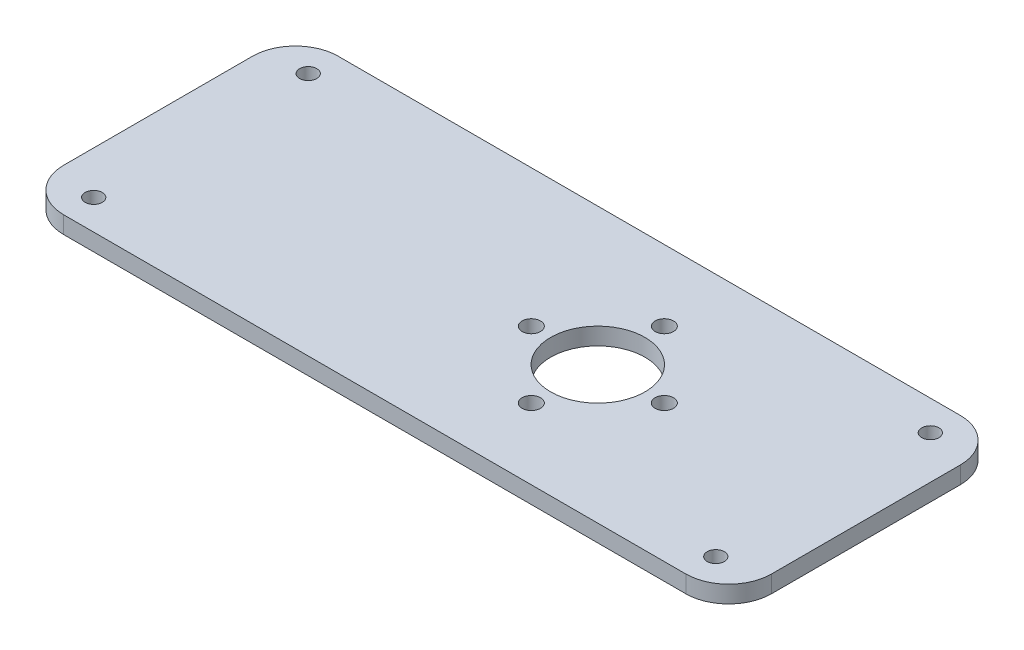
from build123d import *

# Parameters (mm, degrees)
SKETCH_1_W      = 165
SKETCH_1_H      = 64
SKETCH_1_R      = 2
SKETCH_1_R_2    = 2.15
SKETCH_1_R_3    = 11
EXTRUDE_1_DEPTH = 4
FILLET_1_R      = 10


with BuildPart() as part:
    # 草图1 → 凸台-拉伸1 (new body)
    with BuildSketch(Plane(origin=(0, 0, 0), x_dir=(1, 0, 0), z_dir=(0, 1, 0))):
        with Locations((82.5, 32)):
            Rectangle(SKETCH_1_W, SKETCH_1_H)
        with Locations(Location((10, 57, 0), (0, 0, 270))):
            Circle(SKETCH_1_R, mode=Mode.SUBTRACT)
        with Locations(Location((155, 57, 0), (0, 0, 270))):
            Circle(SKETCH_1_R, mode=Mode.SUBTRACT)
        with Locations(Location((155, 7, 0), (0, 0, 270))):
            Circle(SKETCH_1_R, mode=Mode.SUBTRACT)
        with Locations(Location((10, 7, 0), (0, 0, 270))):
            Circle(SKETCH_1_R, mode=Mode.SUBTRACT)
        with Locations(Location((102.5, 47.5, 0), (0, 0, 270))):
            Circle(SKETCH_1_R_2, mode=Mode.SUBTRACT)
        with Locations(Location((87, 32, 0), (0, 0, 270))):
            Circle(SKETCH_1_R_2, mode=Mode.SUBTRACT)
        with Locations(Location((102.5, 16.5, 0), (0, 0, 270))):
            Circle(SKETCH_1_R_2, mode=Mode.SUBTRACT)
        with Locations(Location((118, 32, 0), (0, 0, 270))):
            Circle(SKETCH_1_R_2, mode=Mode.SUBTRACT)
        with Locations(Location((102.5, 32, 0), (0, 0, 270))):
            Circle(SKETCH_1_R_3, mode=Mode.SUBTRACT)
    extrude(amount=EXTRUDE_1_DEPTH)

    # 圆角1
    fillet_1_edges = [part.edges().sort_by_distance(p)[0] for p in [
        (0, 2, -64),
        (165, 2, -64),
        (165, 2, 0),
        (0, 2, 0),
    ]]
    fillet(fillet_1_edges, radius=FILLET_1_R)


solid = part.part
